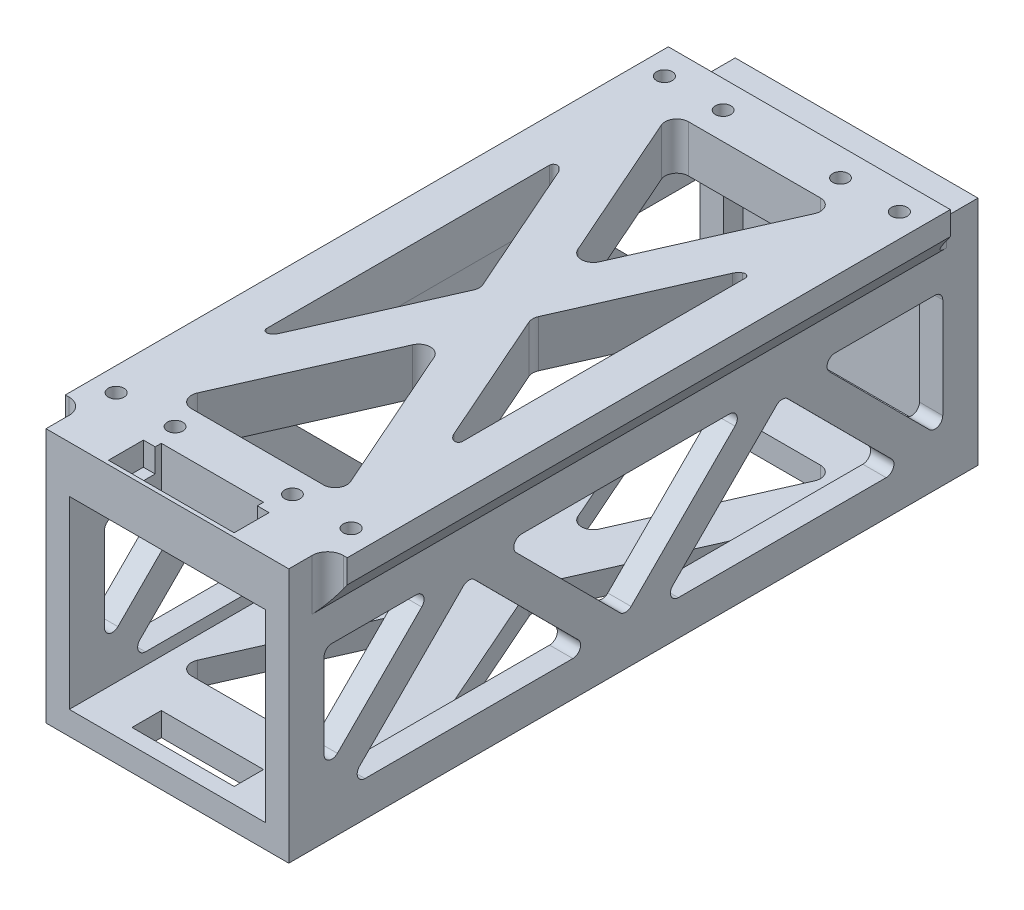
from build123d import *

# Parameters (mm, degrees)
SKETCH1_W                       = 62
SKETCH1_H                       = 172
BOSS_EXTRUDE1_DEPTH             = 6
SKETCH2_W                       = 5.95
SKETCH2_H                       = 172
BOSS_EXTRUDE2_DEPTH             = 47.1
SKETCH3_W                       = 62
SKETCH3_H                       = 172
BOSS_EXTRUDE3_DEPTH             = 6
SKETCH4_W                       = 72
SKETCH4_H                       = 154
SKETCH4_R                       = 2
SKETCH4_R_2                     = 1.97460112
BOSS_EXTRUDE4_DEPTH             = 6
BOSS_EXTRUDE5_REACH             = 115.71
BOSS_EXTRUDE5_DIRECTION_2_REACH = 115.71
FILLET2_R                       = 4
SKETCH6_W                       = 62
SKETCH6_H                       = 59.1
BOSS_EXTRUDE6_DEPTH             = 4
CUT_EXTRUDE1_DEPTH              = 114.528895
CUT_EXTRUDE1_DEPTH_BACK         = 114.528895
SKETCH7_W                       = 26.1
SKETCH7_H                       = 7.5
BOSS_EXTRUDE7_DEPTH             = 6
CUT_EXTRUDE2_DEPTH              = 130.71896546
CUT_EXTRUDE2_DEPTH_BACK         = 130.71896546
CUT_EXTRUDE3_DEPTH              = 117.764763521
CUT_EXTRUDE3_DEPTH_BACK         = 117.764763521


with BuildPart() as part:
    # Sketch1 → Boss-Extrude1 (new body)
    with BuildSketch(Plane(origin=(0, 0, 0), x_dir=(1, 0, 0), z_dir=(0, 1, 0))):
        Rectangle(SKETCH1_W, SKETCH1_H)
    extrude(amount=BOSS_EXTRUDE1_DEPTH)

    # Sketch2 → Boss-Extrude2 (add)
    with BuildSketch(Plane(origin=(0, 6, 0), x_dir=(1, 0, 0), z_dir=(0, 1, 0))):
        with Locations((-28.025, 0)):
            Rectangle(SKETCH2_W, SKETCH2_H)
        with Locations((28.025, 0)):
            Rectangle(SKETCH2_W, SKETCH2_H)
    extrude(amount=BOSS_EXTRUDE2_DEPTH)

    # Sketch3 → Boss-Extrude3 (add)
    with BuildSketch(Plane(origin=(0, 53.1, 0), x_dir=(1, 0, 0), z_dir=(0, 1, 0))):
        Rectangle(SKETCH3_W, SKETCH3_H)
    extrude(amount=BOSS_EXTRUDE3_DEPTH)

    # Sketch4 → Boss-Extrude4 (add)
    with BuildSketch(Plane(origin=(0, 59.1, 0), x_dir=(1, 0, 0), z_dir=(0, 1, 0))):
        with Locations((0, 0.921706982)):
            Rectangle(SKETCH4_W, SKETCH4_H)
        with Locations(Location((-30, 70.921706982, 0), (0, 0, 120))):
            Circle(SKETCH4_R, mode=Mode.SUBTRACT)
        with Locations(Location((-14.985059199, 70.901167372, 0), (0, 0, 270))):
            Circle(SKETCH4_R_2, mode=Mode.SUBTRACT)
        with Locations(Location((14.985059199, 70.901167372, 0), (0, 0, 90))):
            Circle(SKETCH4_R_2, mode=Mode.SUBTRACT)
        with Locations(Location((30, 70.921706982, 0), (0, 0, 90))):
            Circle(SKETCH4_R, mode=Mode.SUBTRACT)
        with Locations(Location((30, -69.078293018, 0), (0, 0, 60))):
            Circle(SKETCH4_R, mode=Mode.SUBTRACT)
        with Locations(Location((14.985059199, -69.057753408, 0), (0, 0, 270))):
            Circle(SKETCH4_R_2, mode=Mode.SUBTRACT)
        with Locations(Location((-14.985059199, -69.057753408, 0), (0, 0, 90))):
            Circle(SKETCH4_R_2, mode=Mode.SUBTRACT)
        with Locations(Location((-30, -69.078293018, 0), (0, 0, 90))):
            Circle(SKETCH4_R, mode=Mode.SUBTRACT)
    extrude(amount=BOSS_EXTRUDE4_DEPTH)

    # Boss-Extrude5: up to this face of the body (flat: up to its plane)
    boss_extrude5_end = Plane(part.part.faces().sort_by_distance((0, 62.1, 76.078293018))[0])
    # Sketch5 → Boss-Extrude5 (add, up to the picked face)
    with BuildSketch(Plane.XY, mode=Mode.PRIVATE) as boss_extrude5_sk1:
        Polygon((-31, 59.1), (-31, 52.1), (-36, 59.1), align=None)
    boss_extrude5_tool1 = split(extrude(boss_extrude5_sk1.sketch, amount=BOSS_EXTRUDE5_REACH, mode=Mode.PRIVATE), bisect_by=boss_extrude5_end, keep=Keep.BOTH, mode=Mode.PRIVATE)
    # Sketch5 → Boss-Extrude5 (add, up to the picked face)
    with BuildSketch(Plane.XY, mode=Mode.PRIVATE) as boss_extrude5_sk2:
        Polygon((36, 59.1), (31, 52.1), (31, 59.1), align=None)
    boss_extrude5_tool2 = split(extrude(boss_extrude5_sk2.sketch, amount=BOSS_EXTRUDE5_REACH, mode=Mode.PRIVATE), bisect_by=boss_extrude5_end, keep=Keep.BOTH, mode=Mode.PRIVATE)
    add(boss_extrude5_tool1.solids().sort_by(Axis((-32.666667, 56.766667, 0), (0, 0, 1)))[0])
    add(boss_extrude5_tool2.solids().sort_by(Axis((32.666667, 56.766667, 0), (0, 0, 1)))[0])

    # Boss-Extrude5 direction 2: up to this face of the body (flat: up to its plane)
    boss_extrude5_direction_2_end = Plane(part.part.faces().sort_by_distance((0, 62.1, -77.921706982))[0])
    # Sketch5 → Boss-Extrude5 direction 2 (add, up to the picked face)
    with BuildSketch(Plane.XY, mode=Mode.PRIVATE) as boss_extrude5_direction_2_sk1:
        Polygon((-31, 59.1), (-31, 52.1), (-36, 59.1), align=None)
    boss_extrude5_direction_2_tool1 = split(extrude(boss_extrude5_direction_2_sk1.sketch, amount=-BOSS_EXTRUDE5_DIRECTION_2_REACH, mode=Mode.PRIVATE), bisect_by=boss_extrude5_direction_2_end, keep=Keep.BOTH, mode=Mode.PRIVATE)
    # Sketch5 → Boss-Extrude5 direction 2 (add, up to the picked face)
    with BuildSketch(Plane.XY, mode=Mode.PRIVATE) as boss_extrude5_direction_2_sk2:
        Polygon((36, 59.1), (31, 52.1), (31, 59.1), align=None)
    boss_extrude5_direction_2_tool2 = split(extrude(boss_extrude5_direction_2_sk2.sketch, amount=-BOSS_EXTRUDE5_DIRECTION_2_REACH, mode=Mode.PRIVATE), bisect_by=boss_extrude5_direction_2_end, keep=Keep.BOTH, mode=Mode.PRIVATE)
    add(boss_extrude5_direction_2_tool1.solids().sort_by(Axis((-32.666667, 56.766667, 0), (0, 0, -1)))[0])
    add(boss_extrude5_direction_2_tool2.solids().sort_by(Axis((32.666667, 56.766667, 0), (0, 0, -1)))[0])

    # Fillet2
    fillet2_edges = [part.edges().sort_by_distance(p)[0] for p in [
        (-31, 55.6, 76.078293018),
        (-31, 55.6, -77.921706982),
        (31, 55.6, 76.078293018),
        (31, 55.6, -77.921706982),
    ]]
    fillet(fillet2_edges, radius=FILLET2_R)

    # Sketch6 → Boss-Extrude6 (add)
    with BuildSketch(Plane(origin=(0, 0, -86), x_dir=(-1, 0, 0), z_dir=(0, 0, -1))):
        with Locations((0, 29.55)):
            Rectangle(SKETCH6_W, SKETCH6_H)
    extrude(amount=BOSS_EXTRUDE6_DEPTH)

    # Sketch7 → Cut-Extrude1 (cut, two sides: drawn at the far end of the back side and taken through both)
    with BuildSketch(Plane(origin=(0, 59.1, 0), x_dir=(1, 0, 0), z_dir=(0, 1, 0)).offset(-CUT_EXTRUDE1_DEPTH_BACK)):
        with Locations((0, -78.25)):
            Rectangle(SKETCH7_W, SKETCH7_H)
    extrude(amount=CUT_EXTRUDE1_DEPTH + CUT_EXTRUDE1_DEPTH_BACK, mode=Mode.SUBTRACT)

    # Sketch8 → Boss-Extrude7 (add)
    with BuildSketch(Plane(origin=(0, 59.1, 0), x_dir=(1, 0, 0), z_dir=(0, 1, 0))):
        with BuildLine():
            Line((-16.05, -76.078293018), (-35, -76.078293018))
            ThreePointArc((-35, -76.078293018), (-32.171572875, -77.249865894), (-31, -80.078293018))
            Line((-31, -80.078293018), (-31, -86))
            Line((-31, -86), (31, -86))
            Line((31, -86), (31, -80.078293018))
            ThreePointArc((31, -80.078293018), (32.171572875, -77.249865894), (35, -76.078293018))
            Line((35, -76.078293018), (16.05, -76.078293018))
            Line((16.05, -76.078293018), (16.05, -85))
            Line((16.05, -85), (-16.05, -85))
            Line((-16.05, -85), (-16.05, -76.078293018))
        make_face()
    extrude(amount=BOSS_EXTRUDE7_DEPTH)

    # Sketch9 → Cut-Extrude2 (cut, two sides: drawn at the far end of the back side and taken through both)
    with BuildSketch(Plane(origin=(31, 0, 0), x_dir=(0, 0, -1), z_dir=(1, 0, 0)).offset(-CUT_EXTRUDE2_DEPTH_BACK)):
        with BuildLine():
            Line((52.04626098, 39.687553098), (77.584021981, 14.085947695))
            ThreePointArc((77.584021981, 14.085947695), (79.764213309, 13.650158135), (81, 15.498394597))
            Line((81, 15.498394597), (81, 41.1))
            ThreePointArc((81, 41.1), (80.414213562, 42.514213562), (79, 43.1))
            Line((79, 43.1), (53.462238999, 43.1))
            ThreePointArc((53.462238999, 43.1), (51.614958051, 41.866520123), (52.04626098, 39.687553098))
        make_face()
        with BuildLine():
            Line((27.95373902, 39.687553098), (1.415978019, 13.083447695))
            ThreePointArc((1.415978019, 13.083447695), (0, 12.495894597), (-1.415978019, 13.083447695))
            Line((-1.415978019, 13.083447695), (-27.95373902, 39.687553098))
            ThreePointArc((-27.95373902, 39.687553098), (-28.385041949, 41.866520123), (-26.537761001, 43.1))
            Line((-26.537761001, 43.1), (26.537761001, 43.1))
            ThreePointArc((26.537761001, 43.1), (28.385041949, 41.866520123), (27.95373902, 39.687553098))
        make_face()
        with BuildLine():
            Line((41.415978019, 39.016552305), (67.95373902, 12.412446902))
            ThreePointArc((67.95373902, 12.412446902), (68.385041949, 10.233479877), (66.537761001, 9))
            Line((66.537761001, 9), (13.462238999, 9))
            ThreePointArc((13.462238999, 9), (11.614958051, 10.233479877), (12.04626098, 12.412446902))
            Line((12.04626098, 12.412446902), (38.584021981, 39.016552305))
            ThreePointArc((38.584021981, 39.016552305), (40, 39.604105403), (41.415978019, 39.016552305))
        make_face()
        with BuildLine():
            Line((-38.584021981, 39.016552305), (-12.04626098, 12.412446902))
            ThreePointArc((-12.04626098, 12.412446902), (-11.614958051, 10.233479877), (-13.462238999, 9))
            Line((-13.462238999, 9), (-66.537761001, 9))
            ThreePointArc((-66.537761001, 9), (-68.385041949, 10.233479877), (-67.95373902, 12.412446902))
            Line((-67.95373902, 12.412446902), (-41.415978019, 39.016552305))
            ThreePointArc((-41.415978019, 39.016552305), (-40, 39.604105403), (-38.584021981, 39.016552305))
        make_face()
        with BuildLine():
            Line((-77, 41.1), (-77, 19.508394597))
            ThreePointArc((-77, 19.508394597), (-75.764213309, 17.660158135), (-73.584021981, 18.095947695))
            Line((-73.584021981, 18.095947695), (-52.04626098, 39.687553098))
            ThreePointArc((-52.04626098, 39.687553098), (-51.614958051, 41.866520123), (-53.462238999, 43.1))
            Line((-53.462238999, 43.1), (-75, 43.1))
            ThreePointArc((-75, 43.1), (-76.414213562, 42.514213562), (-77, 41.1))
        make_face()
    extrude(amount=CUT_EXTRUDE2_DEPTH + CUT_EXTRUDE2_DEPTH_BACK, mode=Mode.SUBTRACT)

    # Sketch11 → Cut-Extrude3 (cut, two sides: drawn at the far end of the back side and taken through both)
    with BuildSketch(Plane(origin=(0, 65.1, 0), x_dir=(1, 0, 0), z_dir=(0, 1, 0)).offset(-CUT_EXTRUDE3_DEPTH_BACK)):
        with BuildLine():
            Line((-25, -35.637298167), (-25, 36.559005148))
            ThreePointArc((-25, 36.559005148), (-24.5, 37.425030552), (-23.5, 37.425030552))
            ThreePointArc((-23.5, 37.425030552), (-22.767203169, 36.830605586), (-22.25528756, 36.03796781))
            Line((-22.25528756, 36.03796781), (-7.092383646, 1.67186696))
            ThreePointArc((-7.092383646, 1.67186696), (-6.837096086, 0.460853491), (-7.092383646, -0.750159978))
            Line((-7.092383646, -0.750159978), (-22.25528756, -35.116260828))
            ThreePointArc((-22.25528756, -35.116260828), (-22.767203169, -35.908898604), (-23.5, -36.503323571))
            ThreePointArc((-23.5, -36.503323571), (-24.5, -36.503323571), (-25, -35.637298167))
        make_face()
        with BuildLine():
            Line((19.583965704, 59.710693513), (2.74471244, 21.545215503))
            ThreePointArc((2.74471244, 21.545215503), (0, 19.756228972), (-2.74471244, 21.545215503))
            Line((-2.74471244, 21.545215503), (-19.583965704, 59.710693513))
            ThreePointArc((-19.583965704, 59.710693513), (-19.352522092, 62.559840003), (-16.839253264, 63.921706982))
            Line((-16.839253264, 63.921706982), (16.839253264, 63.921706982))
            ThreePointArc((16.839253264, 63.921706982), (19.352522092, 62.559840003), (19.583965704, 59.710693513))
        make_face()
        with BuildLine():
            Line((22.25528756, -35.116260828), (7.092383646, -0.750159978))
            ThreePointArc((7.092383646, -0.750159978), (6.837096086, 0.460853491), (7.092383646, 1.67186696))
            Line((7.092383646, 1.67186696), (22.25528756, 36.03796781))
            ThreePointArc((22.25528756, 36.03796781), (22.767203169, 36.830605586), (23.5, 37.425030552))
            ThreePointArc((23.5, 37.425030552), (24.5, 37.425030552), (25, 36.559005148))
            Line((25, 36.559005148), (25, -35.637298167))
            ThreePointArc((25, -35.637298167), (24.5, -36.503323571), (23.5, -36.503323571))
            ThreePointArc((23.5, -36.503323571), (22.767203169, -35.908898604), (22.25528756, -35.116260828))
        make_face()
        with BuildLine():
            Line((19.583965704, -58.788986531), (2.74471244, -20.623508521))
            ThreePointArc((2.74471244, -20.623508521), (0, -18.83452199), (-2.74471244, -20.623508521))
            Line((-2.74471244, -20.623508521), (-19.583965704, -58.788986531))
            ThreePointArc((-19.583965704, -58.788986531), (-19.352522092, -61.638133022), (-16.839253264, -63))
            Line((-16.839253264, -63), (16.839253264, -63))
            ThreePointArc((16.839253264, -63), (19.352522092, -61.638133022), (19.583965704, -58.788986531))
        make_face()
    extrude(amount=CUT_EXTRUDE3_DEPTH + CUT_EXTRUDE3_DEPTH_BACK, mode=Mode.SUBTRACT)


solid = part.part
